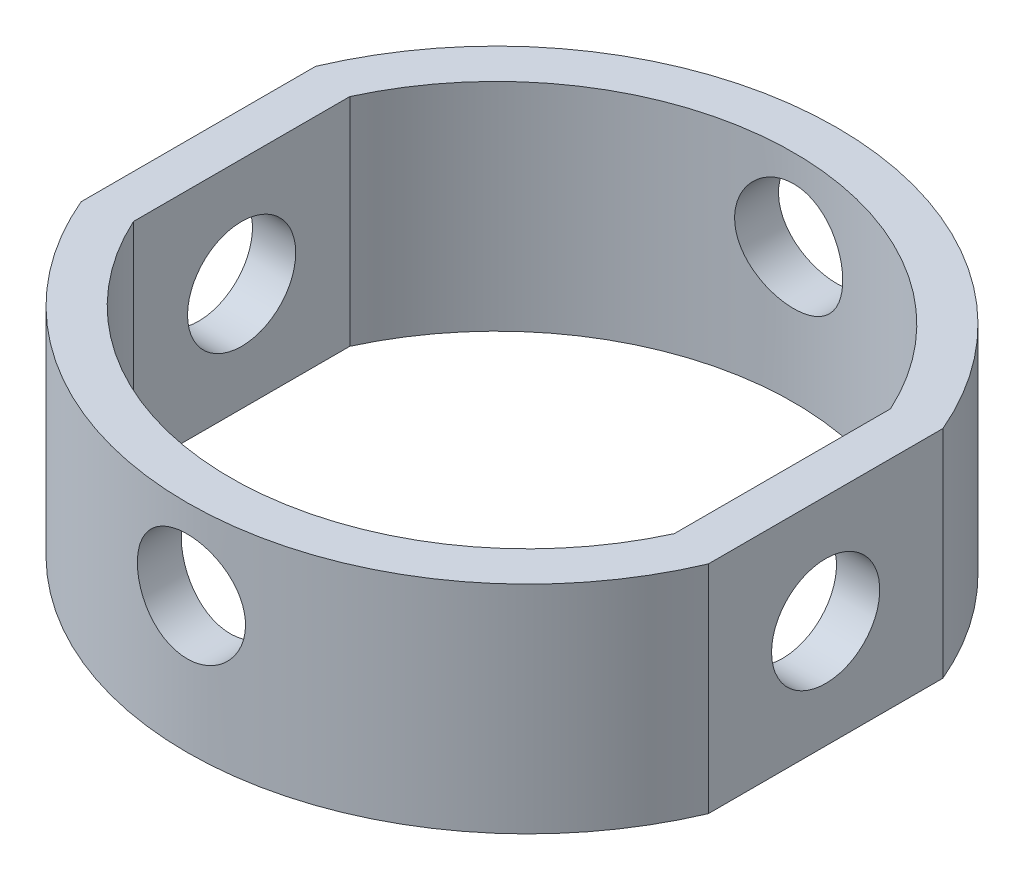
from build123d import *

# Parameters (mm, degrees)
BOSS_EXTRUDE1_DEPTH     = 10
CUT_EXTRUDE1_REACH      = 68.078
SKETCH2_R               = 5
CUT_EXTRUDE2_REACH      = 69.457
CUT_EXTRUDE2_END_RADIUS = 31.503056099
SKETCH3_R               = 5


with BuildPart() as part:
    # Sketch1 → Boss-Extrude1 (new, symmetric)
    with BuildSketch(Plane(origin=(0, 0, 0), x_dir=(1, 0, 0), z_dir=(0, 1, 0))):
        with BuildLine():
            Line((29, 10.842426248), (29, -10.842426248))
            ThreePointArc((29, -10.842426248), (0, -30.039282951), (-29, -10.842426248))
            Line((-29, -10.842426248), (-29, 10.842426248))
            ThreePointArc((-29, 10.842426248), (0, 30.039282951), (29, 10.842426248))
        make_face()
        with BuildLine():
            Line((-25, 10), (-25, -10))
            ThreePointArc((-25, -10), (0, -26.039282951), (25, -10))
            Line((25, -10), (25, 10))
            ThreePointArc((25, 10), (0, 26.039282951), (-25, 10))
        make_face(mode=Mode.SUBTRACT)
    extrude(amount=BOSS_EXTRUDE1_DEPTH, both=True)

    # Cut-Extrude1: up to this face of the body (flat: up to its plane)
    cut_extrude1_end = Plane(part.part.faces().sort_by_distance((29, 0, 0))[0])
    # Sketch2 → Cut-Extrude1 (cut, up to the picked face)
    with BuildSketch(Plane.ZY.offset(29), mode=Mode.PRIVATE) as cut_extrude1_sk1:
        Circle(SKETCH2_R)
    cut_extrude1_tool1 = split(extrude(cut_extrude1_sk1.sketch, amount=-CUT_EXTRUDE1_REACH, mode=Mode.PRIVATE), bisect_by=cut_extrude1_end, keep=Keep.BOTH, mode=Mode.PRIVATE)
    add(cut_extrude1_tool1.solids().sort_by(Axis((-29, 0, 0), (1, 0, 0)))[0], mode=Mode.SUBTRACT)

    # Cut-Extrude2: up to this cylinder (the profile starts inside it)
    cut_extrude2_end = Plane(origin=(0, 2.5, 1.463773147), z_dir=(0, -1, 0)) * Cylinder(CUT_EXTRUDE2_END_RADIUS, 202.920112198, mode=Mode.PRIVATE)
    # Sketch3 → Cut-Extrude2 (cut, up to the surface)
    with BuildSketch(Plane.XY.offset(30.039282951), mode=Mode.PRIVATE) as cut_extrude2_sk1:
        with Locations((0, 2.5)):
            Circle(SKETCH3_R)
    cut_extrude2_tool1 = extrude(cut_extrude2_sk1.sketch, amount=-CUT_EXTRUDE2_REACH, mode=Mode.PRIVATE) & cut_extrude2_end
    add(cut_extrude2_tool1.solids().sort_by_distance((0, 2.5, 30.039283))[0], mode=Mode.SUBTRACT)


solid = part.part
